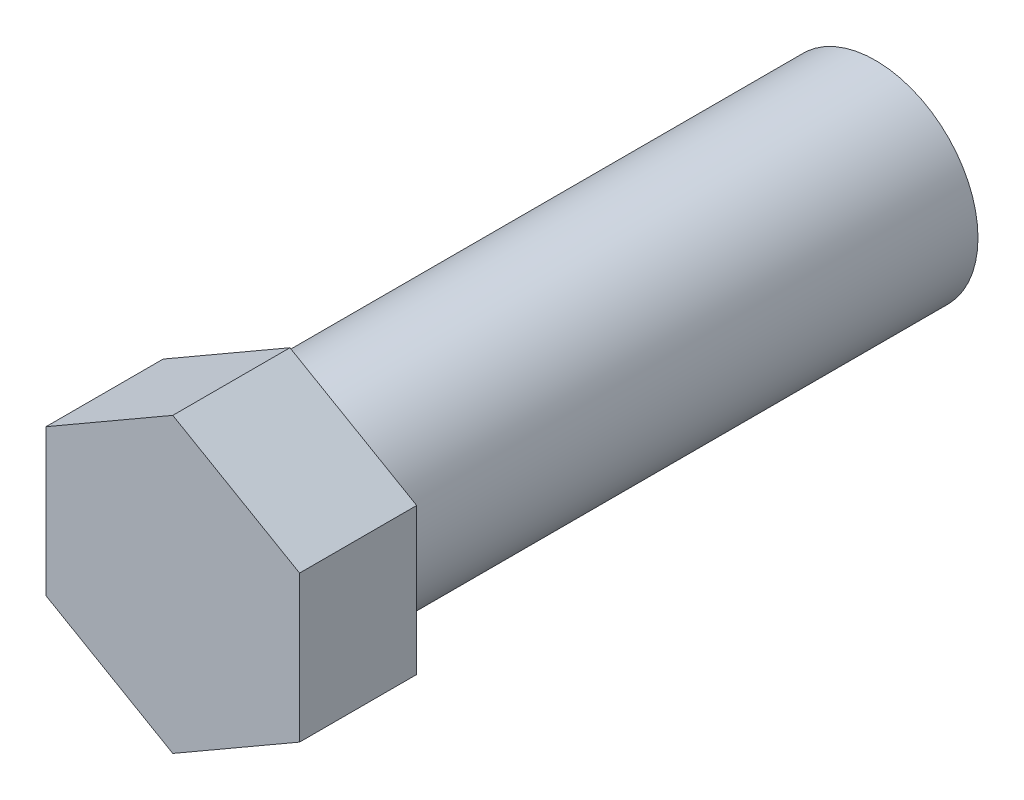
from build123d import *

# Parameters (mm, degrees)
ESQUISSE1_R        = 1.75
BOSS_EXTRU_1_DEPTH = 10
BOSS_EXTRU_2_DEPTH = 2


with BuildPart() as part:
    # Esquisse1 → Boss.-Extru.1 (new body)
    with BuildSketch(Plane.XY):
        Circle(ESQUISSE1_R)
    extrude(amount=BOSS_EXTRU_1_DEPTH)

    # Esquisse2 → Boss.-Extru.2 (add)
    with BuildSketch(Plane.XY.offset(10)):
        Polygon((0, 2.5), (-2.165063509, 1.25), (-2.165063509, -1.25), (0, -2.5), (2.165063509, -1.25), (2.165063509, 1.25), align=None)
    extrude(amount=BOSS_EXTRU_2_DEPTH)


solid = part.part
